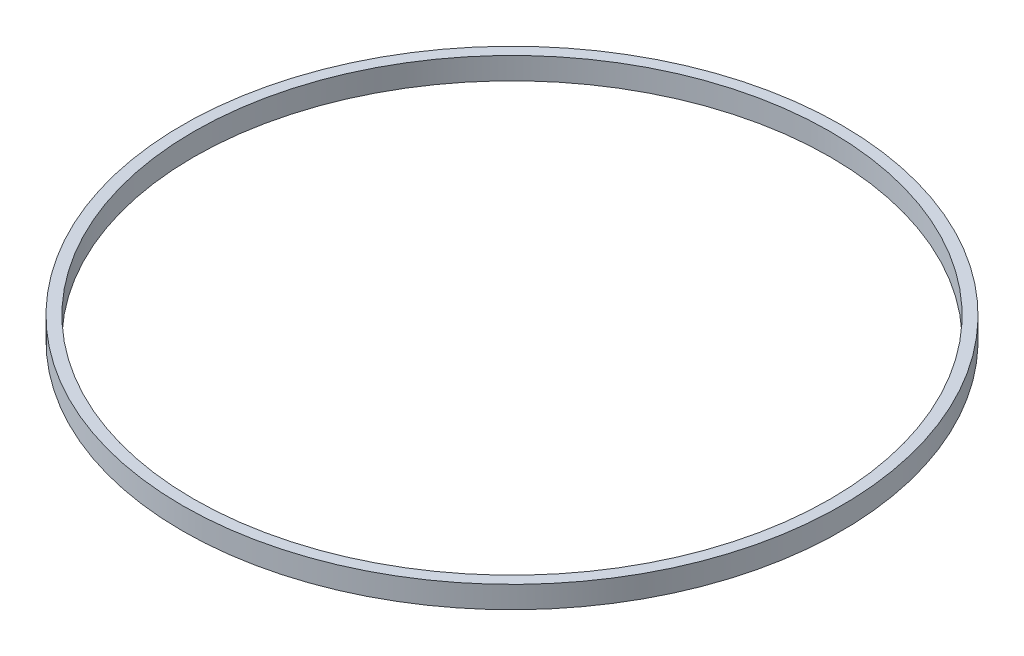
from build123d import *

# Parameters (mm, degrees)
SKETCH1_R           = 1500
SKETCH1_R_2         = 1448.647425295
BOSS_EXTRUDE1_DEPTH = 100


with BuildPart() as part:
    # Sketch1 → Boss-Extrude1 (new body)
    with BuildSketch(Plane(origin=(0, 0, 0), x_dir=(1, 0, 0), z_dir=(0, 1, 0))):
        with Locations(Location((0, 0, 0), (0, 0, 270))):
            Circle(SKETCH1_R)
        with Locations(Location((0, 0, 0), (0, 0, 270))):
            Circle(SKETCH1_R_2, mode=Mode.SUBTRACT)
    extrude(amount=BOSS_EXTRUDE1_DEPTH)


solid = part.part
